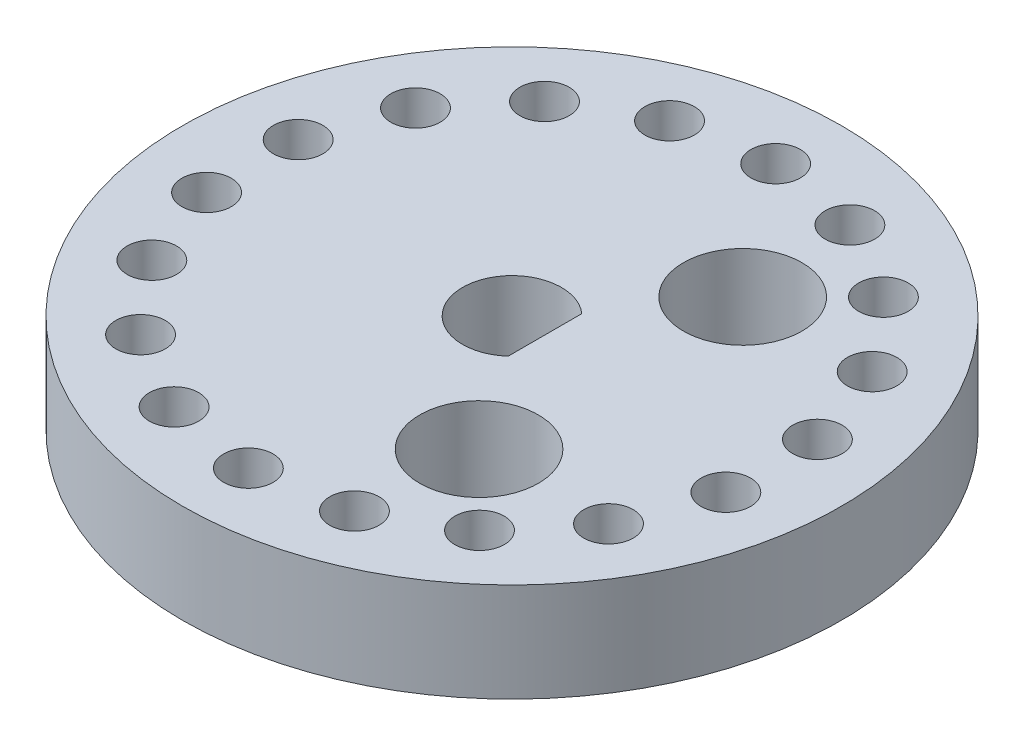
from build123d import *

# Parameters (mm, degrees)
SKETCH_1_R          = 10
EXTRUDE_1_DEPTH     = 3
SKETCH_3_R          = 0.75
CUT_EXTRUDE_2_DEPTH = 15.456832295
SKETCH_4_R          = 1.8
CUT_EXTRUDE_3_DEPTH = 15.456832295
CUT_EXTRUDE_6_REACH = 16.457


with BuildPart() as part:
    # 草图1 → 凸台-拉伸1 (new body)
    with BuildSketch(Plane(origin=(0, 0, 0), x_dir=(1, 0, 0), z_dir=(0, 1, 0))):
        with Locations(Location((0, 0, 0), (0, 0, 270))):
            Circle(SKETCH_1_R)
    extrude(amount=EXTRUDE_1_DEPTH)

    # 草图3 → 切除-拉伸2 (cut, through all)
    with BuildSketch(Plane(origin=(0, 3, 0), x_dir=(1, 0, 0), z_dir=(0, 1, 0))):
        with Locations(Location((0, 8, 0), (0, 0, 270))):
            Circle(SKETCH_3_R)
        with Locations(Location((2.736161147, 7.517540966, 0), (0, 0, 270))):
            Circle(SKETCH_3_R)
        with Locations(Location((5.142300877, 6.128355545, 0), (0, 0, 270))):
            Circle(SKETCH_3_R)
        with Locations(Location((6.92820323, 4, 0), (0, 0, 270))):
            Circle(SKETCH_3_R)
        with Locations(Location((7.878462024, 1.389185421, 0), (0, 0, 270))):
            Circle(SKETCH_3_R)
        with Locations(Location((7.878462024, -1.389185421, 0), (0, 0, 270))):
            Circle(SKETCH_3_R)
        with Locations(Location((6.92820323, -4, 0), (0, 0, 270))):
            Circle(SKETCH_3_R)
        with Locations(Location((5.142300877, -6.128355545, 0), (0, 0, 270))):
            Circle(SKETCH_3_R)
        with Locations(Location((2.736161147, -7.517540966, 0), (0, 0, 270))):
            Circle(SKETCH_3_R)
        with Locations(Location((0, -8, 0), (0, 0, 270))):
            Circle(SKETCH_3_R)
        with Locations(Location((-2.736161147, -7.517540966, 0), (0, 0, 270))):
            Circle(SKETCH_3_R)
        with Locations(Location((-5.142300877, -6.128355545, 0), (0, 0, 270))):
            Circle(SKETCH_3_R)
        with Locations(Location((-6.92820323, -4, 0), (0, 0, 270))):
            Circle(SKETCH_3_R)
        with Locations(Location((-7.878462024, -1.389185421, 0), (0, 0, 270))):
            Circle(SKETCH_3_R)
        with Locations(Location((-7.878462024, 1.389185421, 0), (0, 0, 270))):
            Circle(SKETCH_3_R)
        with Locations(Location((-6.92820323, 4, 0), (0, 0, 270))):
            Circle(SKETCH_3_R)
        with Locations(Location((-5.142300877, 6.128355545, 0), (0, 0, 270))):
            Circle(SKETCH_3_R)
        with Locations(Location((-2.736161147, 7.517540966, 0), (0, 0, 270))):
            Circle(SKETCH_3_R)
    extrude(amount=-CUT_EXTRUDE_2_DEPTH, mode=Mode.SUBTRACT)

    # 草图4 → 切除-拉伸3 (cut, through all)
    with BuildSketch(Plane(origin=(0, 3, 0), x_dir=(1, 0, 0), z_dir=(0, 1, 0))):
        with Locations(Location((3, -4, 0), (0, 0, 270))):
            Circle(SKETCH_4_R)
        with Locations(Location((3, 4, 0), (0, 0, 90))):
            Circle(SKETCH_4_R)
    extrude(amount=-CUT_EXTRUDE_3_DEPTH, mode=Mode.SUBTRACT)

    # 草图2 → 切除-拉伸6 (cut, up to next)
    with BuildSketch(Plane(origin=(0, 3, 0), x_dir=(1, 0, 0), z_dir=(0, 1, 0)), mode=Mode.PRIVATE) as cut_extrude_6_sk1:
        with BuildLine():
            Line((1, -1.118033989), (1, 1.118033989))
            ThreePointArc((1, 1.118033989), (-1.5, 0), (1, -1.118033989))
        make_face()
    cut_extrude_6_tool1 = extrude(cut_extrude_6_sk1.sketch, amount=-CUT_EXTRUDE_6_REACH, mode=Mode.PRIVATE) & part.part
    add(cut_extrude_6_tool1.solids().sort_by_distance((-0.148024, 3, 0))[0], mode=Mode.SUBTRACT)


solid = part.part
